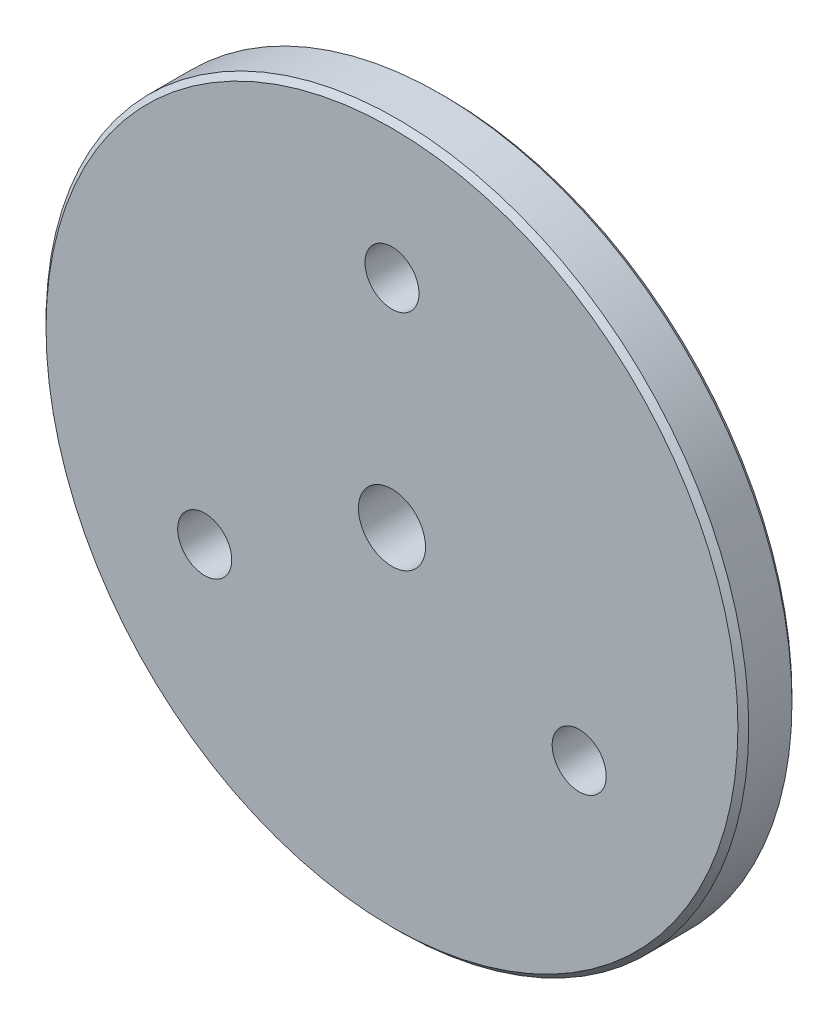
from build123d import *

# Parameters (mm, degrees)
SKETCH1_R           = 32.5
SKETCH1_R_2         = 2.5
BOSS_EXTRUDE1_DEPTH = 5
SKETCH2_R           = 10
BOSS_EXTRUDE2_DEPTH = 14.5
SKETCH3_R           = 3.1
CUT_EXTRUDE1_DEPTH  = 24.5
CUT_EXTRUDE3_START  = -14.5
CUT_EXTRUDE3_DEPTH  = 14.5
SKETCH8_R           = 1.5
CUT_EXTRUDE5_DEPTH  = 5
CHAMFER2_SIZE       = 0.5


with BuildPart() as part:
    # Sketch1 → Boss-Extrude1 (new body)
    with BuildSketch(Plane.XY):
        Circle(SKETCH1_R)
        with Locations((0, 20)):
            Circle(SKETCH1_R_2, mode=Mode.SUBTRACT)
        with Locations((-17.320508076, -10)):
            Circle(SKETCH1_R_2, mode=Mode.SUBTRACT)
        with Locations((17.320508076, -10)):
            Circle(SKETCH1_R_2, mode=Mode.SUBTRACT)
    extrude(amount=BOSS_EXTRUDE1_DEPTH)

    # Sketch2 → Boss-Extrude2 (add)
    with BuildSketch(Plane(origin=(0, 0, 0), x_dir=(-1, 0, 0), z_dir=(0, 0, -1))):
        with Locations(Location((0, 0, 0), (0, 0, 180))):
            Circle(SKETCH2_R)
    extrude(amount=BOSS_EXTRUDE2_DEPTH)

    # Sketch3 → Cut-Extrude1 (cut)
    with BuildSketch(Plane(origin=(0, 0, -14.5), x_dir=(-1, 0, 0), z_dir=(0, 0, -1))):
        Circle(SKETCH3_R)
    extrude(amount=-CUT_EXTRUDE1_DEPTH, mode=Mode.SUBTRACT)

    # Sketch7 → Cut-Extrude3 (cut)
    with BuildSketch(Plane(origin=(0, 0, -14.5), x_dir=(-1, 0, 0), z_dir=(0, 0, -1)).offset(CUT_EXTRUDE3_START)):
        with BuildLine():
            Line((0, 6.5), (-7.599342077, 6.5))
            ThreePointArc((-7.599342077, 6.5), (0, 10), (7.599342077, 6.5))
            Line((7.599342077, 6.5), (0, 6.5))
        make_face()
    extrude(amount=CUT_EXTRUDE3_DEPTH, mode=Mode.SUBTRACT)

    # Sketch8 → Cut-Extrude5 (cut)
    with BuildSketch(Plane(origin=(0, 6.5, 0), x_dir=(1, 0, 0), z_dir=(0, 1, 0))):
        with Locations(Location((0, 7.25, 0), (0, 0, 180))):
            Circle(SKETCH8_R)
    extrude(amount=-CUT_EXTRUDE5_DEPTH, mode=Mode.SUBTRACT)

    # Chamfer2
    chamfer2_edges = [part.edges().sort_by_distance(p)[0] for p in [
        (-32.5, 0, 0),
        (0, -10, -14.5),
        (0, -10, 0),
        (-32.5, 0, 5),
    ]]
    chamfer(chamfer2_edges, length=CHAMFER2_SIZE)


solid = part.part
